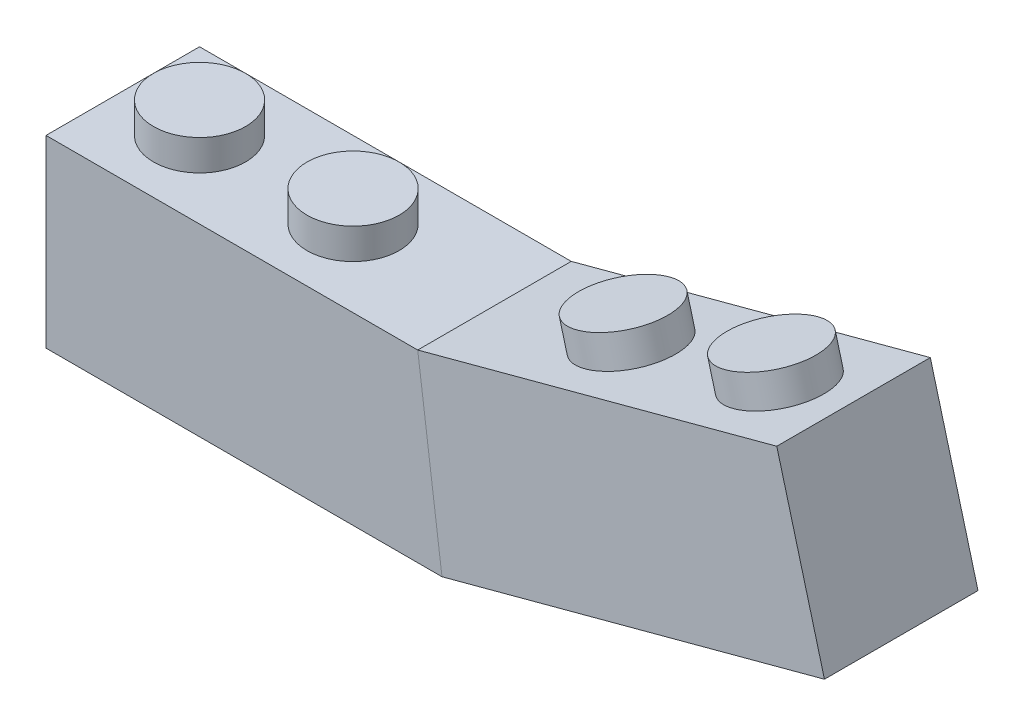
from build123d import *

# Parameters (mm, degrees)
SKETCH2_W           = 8
SKETCH2_H           = 9.6
SKETCH4_R           = 2.4
BOSS_EXTRUDE1_DEPTH = 1.6
LPATTERN1_COUNT     = 2
LPATTERN1_PITCH     = 8
SKETCH5_R           = 2.4
BOSS_EXTRUDE2_DEPTH = 1.6
LPATTERN2_COUNT     = 2
LPATTERN2_PITCH     = 8
SHELL1_T            = -1.6


with BuildPart() as part:
    # Sweep1: sweep along a path in Sketch3
    with BuildLine(Plane.XY) as sweep1_path:
        Line((0, 0), (20, 0))
        Line((20, 0), (39.318516526, 5.176380902))
    # Sketch2 → Sweep1 (sweep)
    with BuildSketch(Plane(origin=(0, 0, 0), x_dir=(0, 0, -1), z_dir=(1, 0, 0))):
        Rectangle(SKETCH2_W, SKETCH2_H)
    sweep(path=sweep1_path.line, transition=Transition.RIGHT)

    # Sketch4 → Boss-Extrude1 (add)
    with BuildSketch(Plane(origin=(0, 4.8, 0), x_dir=(1, 0, 0), z_dir=(0, 1, 0))):
        with Locations(Location((4, 0, 0), (0, 0, 270))):
            Circle(SKETCH4_R)
    boss_extrude1 = extrude(amount=BOSS_EXTRUDE1_DEPTH)

    # LPattern1: Boss-Extrude1 ×2
    with Locations(*[(i * LPATTERN1_PITCH, 0, 0) for i in range(1, LPATTERN1_COUNT)]):
        add(boss_extrude1)

    # Sketch5 → Boss-Extrude2 (add)
    with BuildSketch(Plane(origin=(0.097414546, -0.363556034, 0), x_dir=(0.9659258262890681, 0.2588190451025216, 0), z_dir=(-0.2588190451025216, 0.9659258262890681, 0))):
        with Locations(Location((35.318516526, 0, 0), (0, 0, 180))):
            Circle(SKETCH5_R)
    boss_extrude2 = extrude(amount=BOSS_EXTRUDE2_DEPTH)

    # LPattern2: Boss-Extrude2 ×2
    with Locations(*[Vector(-0.9659258262890681, -0.2588190451025219, 0) * (i * LPATTERN2_PITCH) for i in range(1, LPATTERN2_COUNT)]):
        add(boss_extrude2)

    # Shell1
    shell1_openings = [part.faces().sort_by_distance(p)[0] for p in [
        (10.315965994, -4.8, 0),
        (30.596389965, -2.130031532, 0),
    ]]
    offset(amount=SHELL1_T, openings=shell1_openings, kind=Kind.INTERSECTION)


solid = part.part
